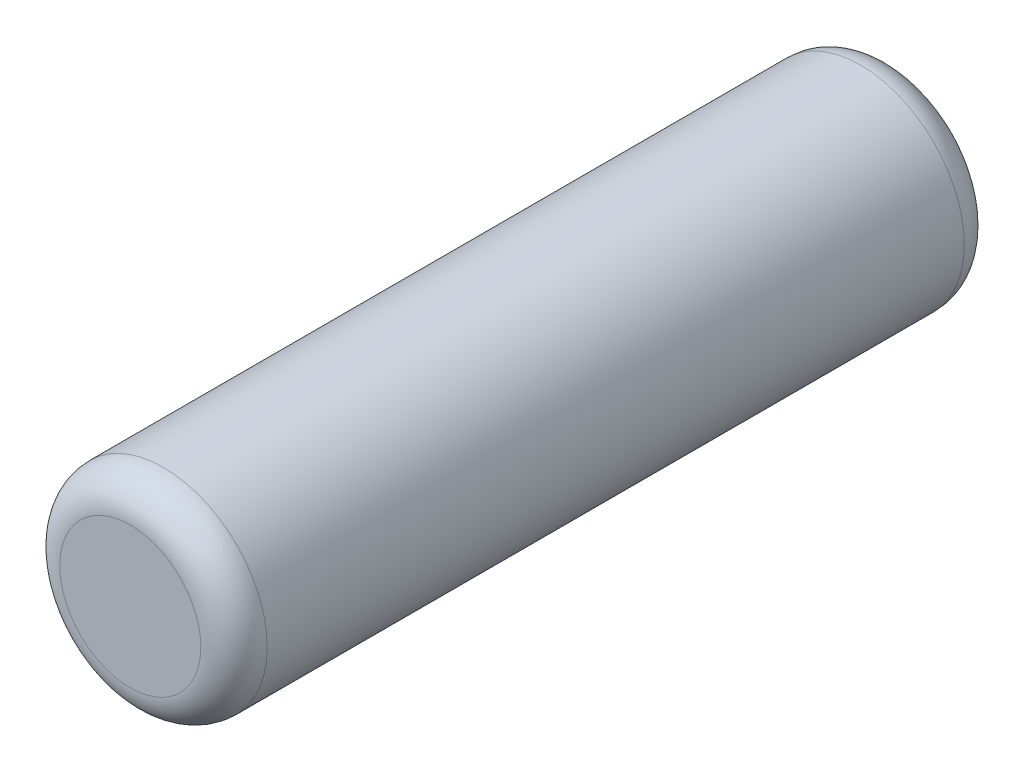
from build123d import *

# Parameters (mm, degrees)
SKETCH1_R           = 6.25
BOSS_EXTRUDE1_DEPTH = 23
FILLET1_R           = 2


with BuildPart() as part:
    # Sketch1 → Boss-Extrude1 (new, symmetric)
    with BuildSketch(Plane.XY):
        Circle(SKETCH1_R)
    extrude(amount=BOSS_EXTRUDE1_DEPTH, both=True)

    # Fillet1
    fillet1_edges = [part.edges().sort_by_distance(p)[0] for p in [
        (-6.25, 0, -23),
        (-6.25, 0, 23),
    ]]
    fillet(fillet1_edges, radius=FILLET1_R)


solid = part.part
